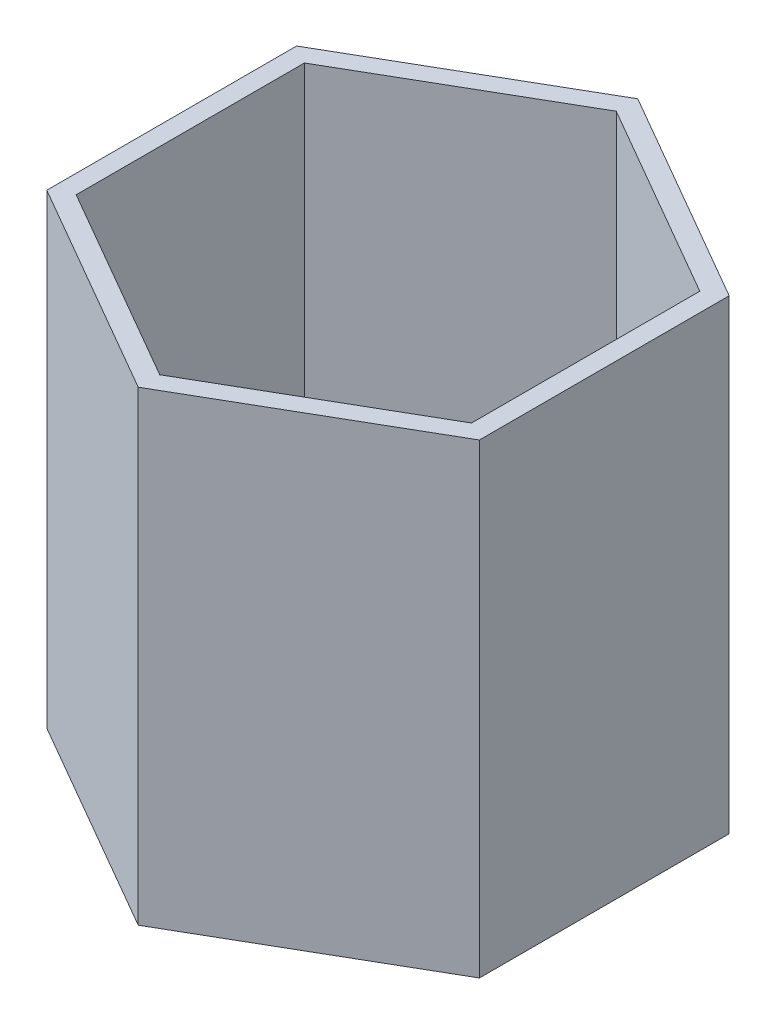
from build123d import *

# Parameters (mm, degrees)
BOSS_EXTRUDE2_DEPTH = 3
BOSS_EXTRUDE3_DEPTH = 50


with BuildPart() as part:
    # Sketch1 → Boss-Extrude2 (new body)
    with BuildSketch(Plane(origin=(0, 0, 0), x_dir=(1, 0, 0), z_dir=(0, 1, 0))):
        Polygon((23.212466677, 13.401723884), (0, 26.803447769), (-23.212466677, 13.401723884), (-23.212466677, -13.401723884), (0, -26.803447769), (23.212466677, -13.401723884), align=None)
    extrude(amount=BOSS_EXTRUDE2_DEPTH)

    # Sketch1<4> → Boss-Extrude3 (add)
    with BuildSketch(Plane(origin=(0, 0, 0), x_dir=(1, 0, 0), z_dir=(0, 1, 0))):
        Polygon((0, 26.803447769), (-23.212466677, 13.401723884), (-23.212466677, -13.401723884), (0, -26.803447769), (23.212466677, -13.401723884), (23.212466677, 13.401723884), align=None)
        Polygon((21.212466677, 12.247023346), (0, 24.494046692), (-21.212466677, 12.247023346), (-21.212466677, -12.247023346), (0, -24.494046692), (21.212466677, -12.247023346), align=None, mode=Mode.SUBTRACT)
    extrude(amount=BOSS_EXTRUDE3_DEPTH)


solid = part.part
